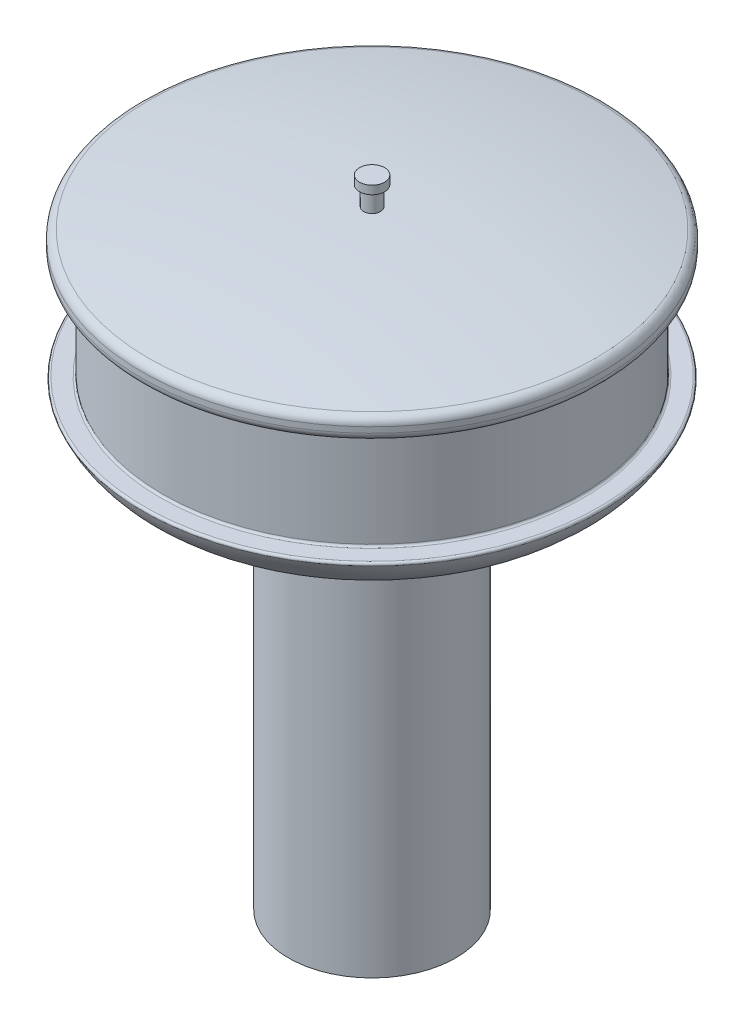
from build123d import *

# Parameters (mm, degrees)
SKETCH2_R           = 3
BOSS_EXTRUDE1_DEPTH = 2


with BuildPart() as part:
    # Sketch1 → Revolve1 (revolve)
    with BuildSketch(Plane.XY, mode=Mode.PRIVATE) as revolve1_sk:
        with BuildLine():
            Line((18, -40), (20, -40))
            Line((20, -40), (20, 58))
            ThreePointArc((20, 58), (20.585786438, 59.414213562), (22, 60))
            Line((22, 60), (40, 60))
            ThreePointArc((40, 60), (48.825645043, 62.654289469), (54.723062999, 69.736501303))
            ThreePointArc((54.723062999, 69.736501303), (54.680020734, 70.208037045), (54.26296728, 70.432235637))
            Line((54.26296728, 70.432235637), (50.5, 70.432235637))
            ThreePointArc((50.5, 70.432235637), (50.146446609, 70.578682247), (50, 70.932235637))
            Line((50, 70.932235637), (50, 94.932235637))
            ThreePointArc((50, 94.932235637), (50.146446609, 95.285789028), (50.5, 95.432235637))
            Line((50.5, 95.432235637), (53, 95.432235637))
            ThreePointArc((53, 95.432235637), (54.414213562, 96.018022075), (55, 97.432235637))
            Line((55, 97.432235637), (55, 98.770348737))
            ThreePointArc((55, 98.770348737), (54.536374032, 100.050799764), (53.360445168, 100.737600445))
            ThreePointArc((53.360445168, 100.737600445), (27.785995436, 104.234972802), (2, 105.40396034))
            Line((2, 105.40396034), (2, 110))
            Line((2, 110), (0, 110))
            Line((0, 110), (0, 108))
            Line((0, 108), (0, 103.3968927))
            ThreePointArc((0, 103.3968927), (26.6089664, 102.331900045), (53, 98.770348737))
            Line((53, 98.770348737), (53, 97.432235637))
            Line((53, 97.432235637), (50.5, 97.432235637))
            ThreePointArc((50.5, 97.432235637), (48.732233047, 96.70000259), (48, 94.932235637))
            Line((48, 94.932235637), (48, 70.932235637))
            ThreePointArc((48, 70.932235637), (48.732233047, 69.164468684), (50.5, 68.432235637))
            Line((50.5, 68.432235637), (51.778325116, 68.432235637))
            ThreePointArc((51.778325116, 68.432235637), (46.710115458, 63.712837979), (40, 62))
            Line((40, 62), (22, 62))
            ThreePointArc((22, 62), (19.171572875, 60.828427125), (18, 58))
            Line((18, 58), (18, -40))
        make_face()
    revolve(revolve1_sk.sketch.rotate(Axis((0, 0, 0), (0, 1, 0)), 90), axis=Axis((0, 0, 0), (0, 1, 0)))

    # Sketch2 → Boss-Extrude1 (add)
    with BuildSketch(Plane(origin=(0, 110, 0), x_dir=(1, 0, 0), z_dir=(0, 1, 0))):
        with Locations(Location((0, 0, 0), (0, 0, 270))):
            Circle(SKETCH2_R)
    extrude(amount=BOSS_EXTRUDE1_DEPTH)


solid = part.part
